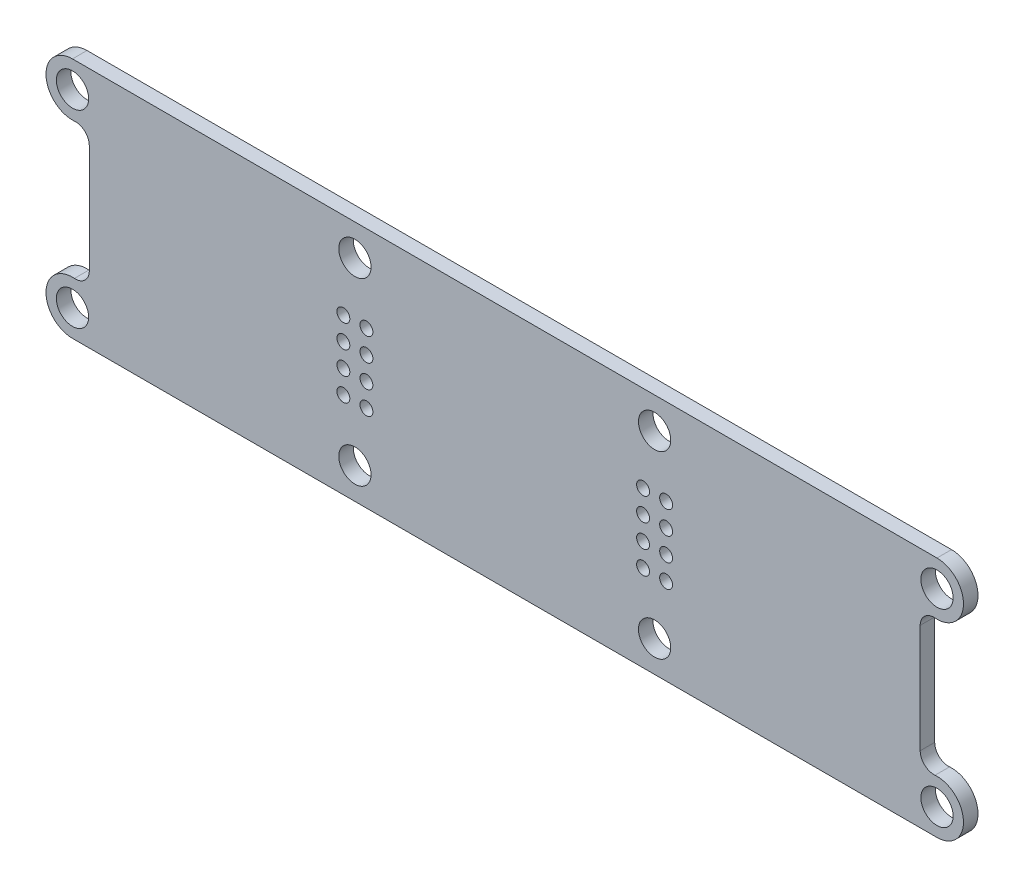
from build123d import *

# Parameters (mm, degrees)
BOSS_EXTRUDE1_DEPTH     = 0.8
SKETCH2_R               = 0.3556
CUT_EXTRUDE1_DEPTH      = 27.149953829
CUT_EXTRUDE2_DEPTH      = 27.149953829
CUT_EXTRUDE2_DEPTH_BACK = 27.149953829
SKETCH3_R               = 0.889


with BuildPart() as part:
    # Sketch1 → Boss-Extrude1 (new body)
    with BuildSketch(Plane(origin=(0, 0, -38.7925), x_dir=(-1, 0, 0), z_dir=(0, 0, -1))):
        with BuildLine():
            Line((23.8125, 6.6675), (-23.8125, 6.6675))
            ThreePointArc((-23.8125, 6.6675), (-25.272010309, 5.153242143), (-23.705057143, 3.750457422))
            ThreePointArc((-23.705057143, 3.750457422), (-23.130382387, 3.548805041), (-22.887, 2.990522163))
            Line((-22.887, 2.990522163), (-22.887, -2.990522163))
            ThreePointArc((-22.887, -2.990522163), (-23.130382387, -3.548805041), (-23.705057143, -3.750457422))
            ThreePointArc((-23.705057143, -3.750457422), (-25.272010309, -5.153242143), (-23.8125, -6.6675))
            Line((-23.8125, -6.6675), (23.8125, -6.6675))
            ThreePointArc((23.8125, -6.6675), (25.272010309, -5.153242143), (23.705057143, -3.750457422))
            ThreePointArc((23.705057143, -3.750457422), (23.130382387, -3.548805041), (22.887, -2.990522163))
            Line((22.887, -2.990522163), (22.887, 2.990522163))
            ThreePointArc((22.887, 2.990522163), (23.130382387, 3.548805041), (23.705057143, 3.750457422))
            ThreePointArc((23.705057143, 3.750457422), (25.272010309, 5.153242143), (23.8125, 6.6675))
        make_face()
    extrude(amount=BOSS_EXTRUDE1_DEPTH)

    # Sketch2 → Cut-Extrude1 (cut, through all)
    with BuildSketch(Plane(origin=(0, 0, -39.5925), x_dir=(-1, 0, 0), z_dir=(0, 0, -1))):
        with Locations((-7.62, -1.905)):
            Circle(SKETCH2_R)
        with Locations((-8.89, -1.905)):
            Circle(SKETCH2_R)
        with Locations((-7.62, 1.905)):
            Circle(SKETCH2_R)
        with Locations((-8.89, 1.905)):
            Circle(SKETCH2_R)
        with Locations((-7.62, 0.635)):
            Circle(SKETCH2_R)
        with Locations((-8.89, 0.635)):
            Circle(SKETCH2_R)
        with Locations((-7.62, -0.635)):
            Circle(SKETCH2_R)
        with Locations((-8.89, -0.635)):
            Circle(SKETCH2_R)
        with Locations((8.89, 1.905)):
            Circle(SKETCH2_R)
        with Locations((7.62, 1.905)):
            Circle(SKETCH2_R)
        with Locations((8.89, -1.905)):
            Circle(SKETCH2_R)
        with Locations((7.62, -1.905)):
            Circle(SKETCH2_R)
        with Locations((8.89, -0.635)):
            Circle(SKETCH2_R)
        with Locations((7.62, -0.635)):
            Circle(SKETCH2_R)
        with Locations((8.89, 0.635)):
            Circle(SKETCH2_R)
        with Locations((7.62, 0.635)):
            Circle(SKETCH2_R)
    extrude(amount=-CUT_EXTRUDE1_DEPTH, mode=Mode.SUBTRACT)

    # Sketch3 → Cut-Extrude2 (cut, two sides: drawn at the far end of the back side and taken through both)
    with BuildSketch(Plane(origin=(0, 0, -39.5925), x_dir=(-1, 0, 0), z_dir=(0, 0, -1)).offset(-CUT_EXTRUDE2_DEPTH_BACK)):
        with Locations((-23.8125, 5.207)):
            Circle(SKETCH3_R)
        with Locations((-23.8125, -5.207)):
            Circle(SKETCH3_R)
        with Locations((23.8125, 5.207)):
            Circle(SKETCH3_R)
        with Locations((23.8125, -5.207)):
            Circle(SKETCH3_R)
        with Locations((-8.255, 4.953)):
            Circle(SKETCH3_R)
        with Locations((8.255, 4.953)):
            Circle(SKETCH3_R)
        with Locations((8.255, -4.953)):
            Circle(SKETCH3_R)
        with Locations((-8.255, -4.953)):
            Circle(SKETCH3_R)
    extrude(amount=CUT_EXTRUDE2_DEPTH + CUT_EXTRUDE2_DEPTH_BACK, mode=Mode.SUBTRACT)


solid = part.part
